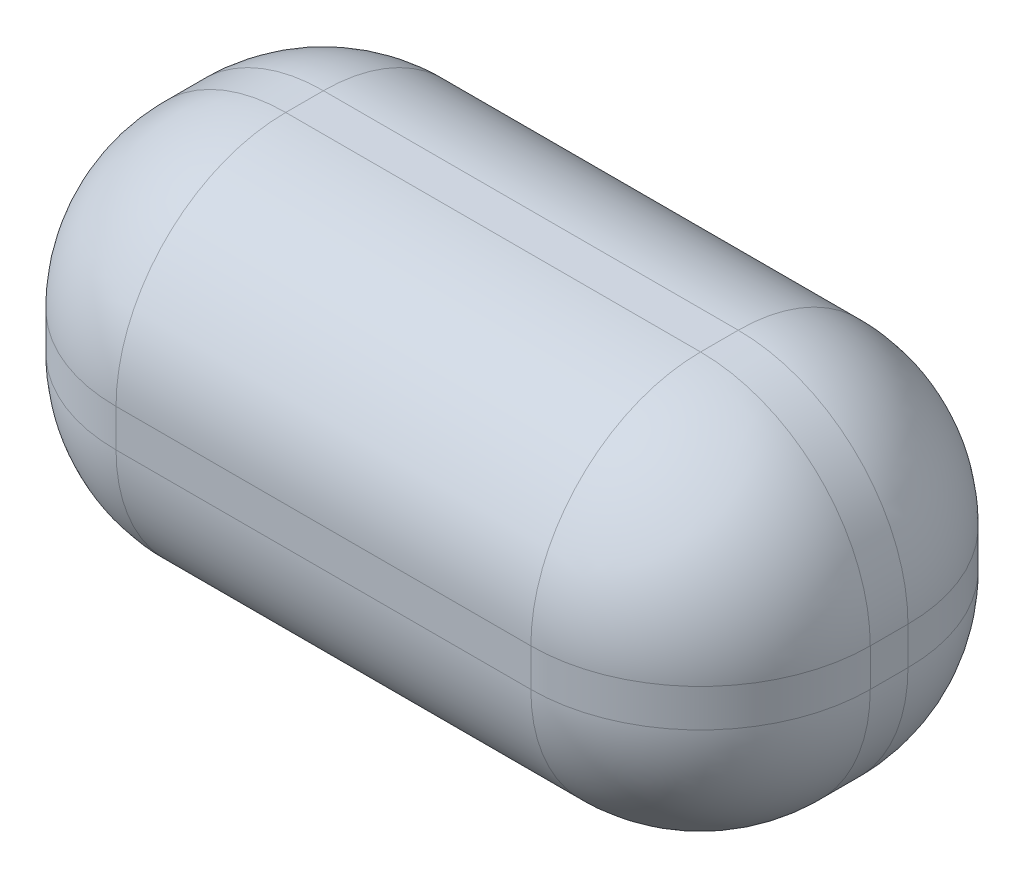
from build123d import *

# Parameters (mm, degrees)
SKETCH1_W           = 200
SKETCH1_H           = 100
BOSS_EXTRUDE1_DEPTH = 50
FILLET1_R           = 45


with BuildPart() as part:
    # Sketch1 → Boss-Extrude1 (new, symmetric)
    with BuildSketch(Plane.XY):
        Rectangle(SKETCH1_W, SKETCH1_H)
    extrude(amount=BOSS_EXTRUDE1_DEPTH, both=True)

    # Fillet1
    fillet1_edges = [part.edges().sort_by_distance(p)[0] for p in [
        (-100, 0, 50),
        (0, -50, 50),
        (100, 0, 50),
        (0, -50, -50),
        (-100, 0, -50),
        (0, 50, -50),
        (100, 0, -50),
        (100, -50, 0),
        (-100, -50, 0),
        (-100, 50, 0),
        (100, 50, 0),
        (0, 50, 50),
    ]]
    fillet(fillet1_edges, radius=FILLET1_R)


solid = part.part
